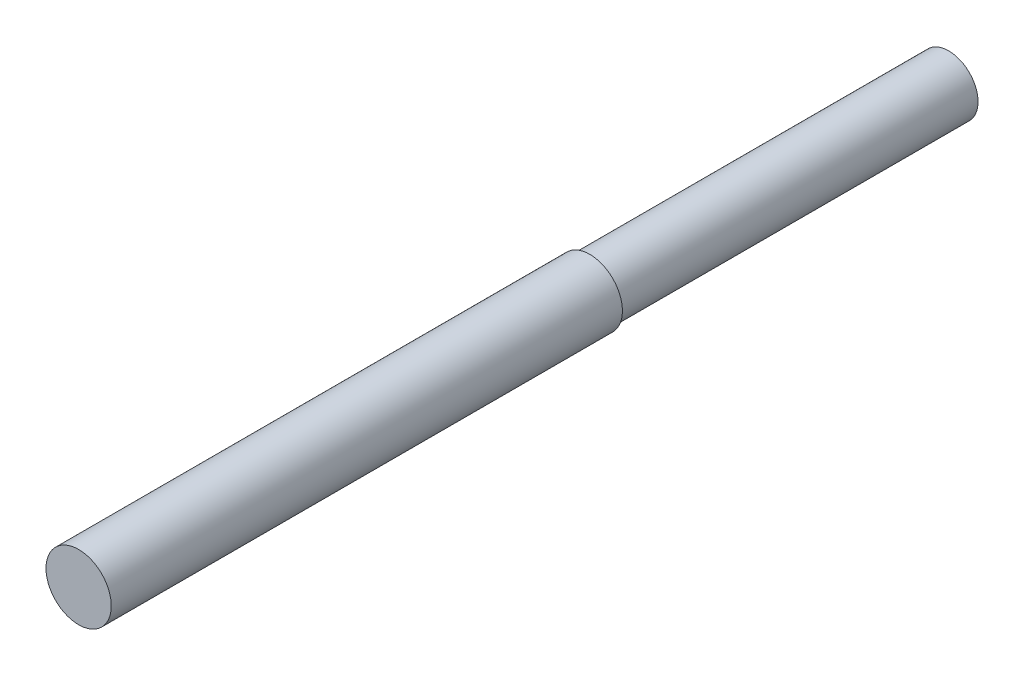
from build123d import *

# Parameters (mm, degrees)
SKETCH_1_R      = 30
EXTRUDE_1_DEPTH = 470
SKETCH_2_R      = 27
EXTRUDE_2_DEPTH = 330


with BuildPart() as part:
    # 草图1 → 凸台-拉伸1 (new body)
    with BuildSketch(Plane.XY):
        with Locations(Location((0, 0, 0), (0, 0, 180))):
            Circle(SKETCH_1_R)
    extrude(amount=EXTRUDE_1_DEPTH)

    # 草图2 → 凸台-拉伸2 (add)
    with BuildSketch(Plane(origin=(0, 0, 0), x_dir=(-1, 0, 0), z_dir=(0, 0, -1))):
        Circle(SKETCH_2_R)
    extrude(amount=EXTRUDE_2_DEPTH)


solid = part.part
